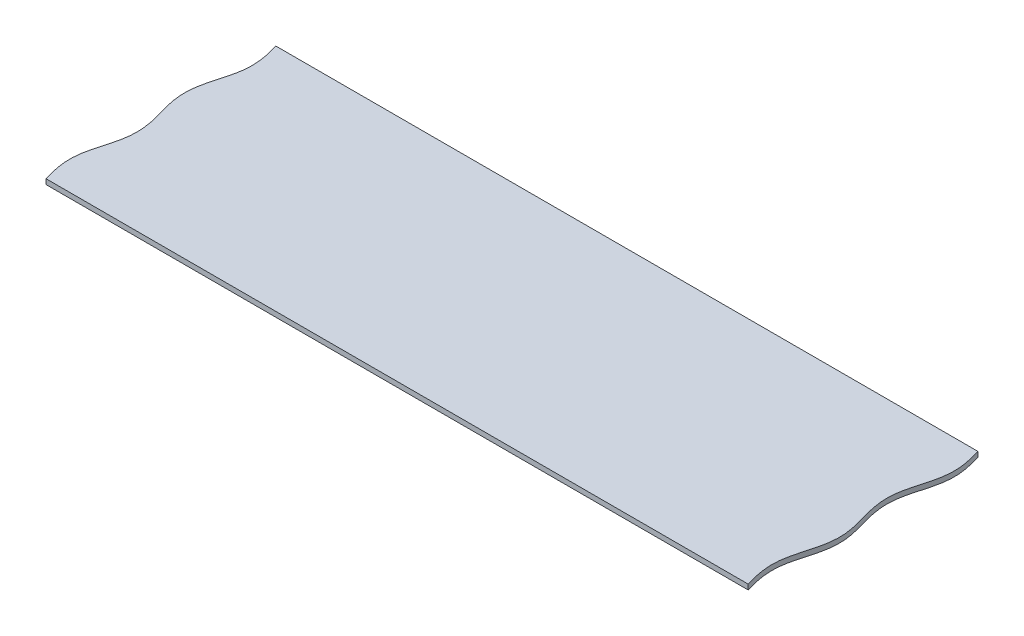
from build123d import *

# Parameters (mm, degrees)
BOSS_EXTRUDE1_DEPTH = 0.4


with BuildPart() as part:
    # Sketch1 → Boss-Extrude1 (new body)
    with BuildSketch(Plane(origin=(0, 0, 0), x_dir=(1, 0, 0), z_dir=(0, 1, 0))):
        with BuildLine():
            Line((0, 0), (55, 0))
            add(Edge.make_bspline(
                [(55, 0), (55.033262254, -0.11910992), (55.082991541, -0.297189427), (55.189772351, -0.69095155), (55.257898591, -0.997698602), (55.325744816, -1.336345897), (55.368877768, -1.648938844), (55.398888986, -1.994468715), (55.403875393, -2.331105954), (55.387597755, -2.672397061), (55.344466555, -3.051244756), (55.269643322, -3.469311628), (55.151200158, -3.964185261), (54.990401734, -4.536028524), (54.817141498, -5.150727725), (54.667523026, -5.816335608), (54.587580107, -6.495028261), (54.600388862, -7.223123132), (54.742130419, -8.108654486), (55.002450481, -9.007873921), (55.261734401, -9.907459056), (55.401315475, -10.790521339), (55.412936347, -11.513899459), (55.332704186, -12.19014491), (55.183645522, -12.853043473), (55.01119991, -13.465115176), (54.850570507, -14.036186493), (54.732045155, -14.53063447), (54.657008519, -14.948661692), (54.613640075, -15.327481905), (54.59713117, -15.668761216), (54.601881624, -16.005402716), (54.63167005, -16.350951124), (54.674614398, -16.66357237), (54.742311673, -17.002247722), (54.810304458, -17.309028986), (54.917025725, -17.702804036), (54.966737826, -17.88089003), (55, -18)],
                knots=[0.082954934, 0.082954934, 0.082954934, 0.082954934, 0.082954934, 0.109918584, 0.12340041, 0.136882236, 0.152330914, 0.167779593, 0.183228217, 0.198676842, 0.214125488, 0.229574134, 0.252675637, 0.27577714, 0.306674483, 0.337571825, 0.368826832, 0.399724073, 0.430621367, 0.469600647, 0.53139537, 0.56987402, 0.600771291, 0.631668595, 0.662565916, 0.693391747, 0.724217578, 0.747319081, 0.770420585, 0.785869231, 0.801317877, 0.816766502, 0.832215126, 0.847663804, 0.863112482, 0.876594308, 0.890076134, 0.917039786, 0.917039786, 0.917039786, 0.917039786, 0.917039786], degree=4))
            Line((55, -18), (0, -18))
            add(Edge.make_bspline(
                [(0, 0), (0.033262254, -0.11910992), (0.082991541, -0.297189427), (0.189772351, -0.69095155), (0.257898591, -0.997698602), (0.325744816, -1.336345897), (0.368877768, -1.648938844), (0.398888986, -1.994468715), (0.403875393, -2.331105954), (0.387597755, -2.672397061), (0.344466555, -3.051244756), (0.269643322, -3.469311628), (0.151200158, -3.964185261), (-0.009598266, -4.536028524), (-0.182858502, -5.150727725), (-0.332476974, -5.816335608), (-0.412419893, -6.495028261), (-0.399611138, -7.223123132), (-0.257869581, -8.108654486), (0.002450481, -9.007873921), (0.261734401, -9.907459056), (0.401315475, -10.790521339), (0.412936347, -11.513899459), (0.332704186, -12.19014491), (0.183645522, -12.853043473), (0.01119991, -13.465115176), (-0.149429493, -14.036186493), (-0.267954845, -14.53063447), (-0.342991481, -14.948661692), (-0.386359925, -15.327481905), (-0.40286883, -15.668761216), (-0.398118376, -16.005402716), (-0.36832995, -16.350951124), (-0.325385602, -16.66357237), (-0.257688327, -17.002247722), (-0.189695542, -17.309028986), (-0.082974275, -17.702804036), (-0.033262174, -17.88089003), (0, -18)],
                knots=[0.082954934, 0.082954934, 0.082954934, 0.082954934, 0.082954934, 0.109918584, 0.12340041, 0.136882236, 0.152330914, 0.167779593, 0.183228217, 0.198676842, 0.214125488, 0.229574134, 0.252675637, 0.27577714, 0.306674483, 0.337571825, 0.368826832, 0.399724073, 0.430621367, 0.469600647, 0.53139537, 0.56987402, 0.600771291, 0.631668595, 0.662565916, 0.693391747, 0.724217578, 0.747319081, 0.770420585, 0.785869231, 0.801317877, 0.816766502, 0.832215126, 0.847663804, 0.863112482, 0.876594308, 0.890076134, 0.917039786, 0.917039786, 0.917039786, 0.917039786, 0.917039786], degree=4))
        make_face()
    extrude(amount=BOSS_EXTRUDE1_DEPTH)


solid = part.part
